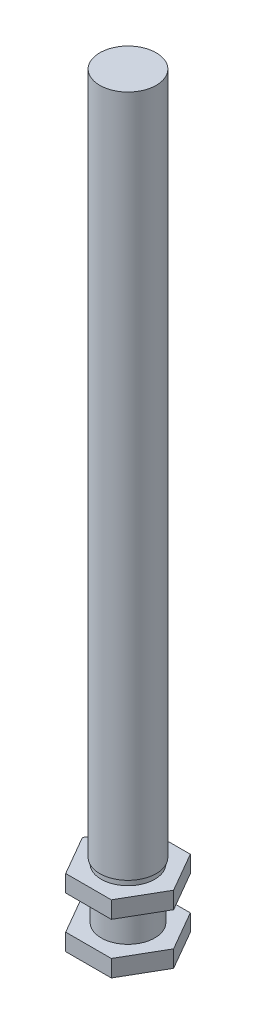
from build123d import *

# Parameters (mm, degrees)
SKETCH1_R           = 4.75
BOSS_EXTRUDE1_DEPTH = 14
BOSS_EXTRUDE2_DEPTH = 3
BOSS_EXTRUDE3_DEPTH = 3
SKETCH4_R           = 5
BOSS_EXTRUDE4_DEPTH = 15
SKETCH5_R           = 5
BOSS_EXTRUDE5_DEPTH = 106


with BuildPart() as part:
    # Sketch1 → Boss-Extrude1 (new body)
    with BuildSketch(Plane(origin=(0, 72.5, 0), x_dir=(1, 0, 0), z_dir=(0, 1, 0))):
        with Locations(Location((0, -26, 0), (0, 0, 270))):
            Circle(SKETCH1_R)
    extrude(amount=BOSS_EXTRUDE1_DEPTH)

    # Sketch2 → Boss-Extrude2 (add)
    with BuildSketch(Plane(origin=(0, 73.5, 0), x_dir=(1, 0, 0), z_dir=(0, 1, 0))):
        Polygon((8.082903769, -26), (4.041451884, -19), (-4.041451884, -19), (-8.082903769, -26), (-4.041451884, -33), (4.041451884, -33), align=None)
    extrude(amount=BOSS_EXTRUDE2_DEPTH)

    # Sketch3 → Boss-Extrude3 (add)
    with BuildSketch(Plane(origin=(0, 82.5, 0), x_dir=(1, 0, 0), z_dir=(0, 1, 0))):
        Polygon((8.082903769, -26), (4.041451884, -19), (-4.041451884, -19), (-8.082903769, -26), (-4.041451884, -33), (4.041451884, -33), align=None)
    extrude(amount=BOSS_EXTRUDE3_DEPTH)

    # Sketch4 → Boss-Extrude4 (add)
    with BuildSketch(Plane(origin=(0, 86.5, 0), x_dir=(1, 0, 0), z_dir=(0, 1, 0))):
        with Locations(Location((0, -26, 0), (0, 0, 270))):
            Circle(SKETCH4_R)
    extrude(amount=BOSS_EXTRUDE4_DEPTH)

    # Sketch5 → Boss-Extrude5 (add)
    with BuildSketch(Plane(origin=(0, 101.5, 0), x_dir=(1, 0, 0), z_dir=(0, 1, 0))):
        with Locations(Location((0, -26, 0), (0, 0, 270))):
            Circle(SKETCH5_R)
    extrude(amount=BOSS_EXTRUDE5_DEPTH)


solid = part.part
